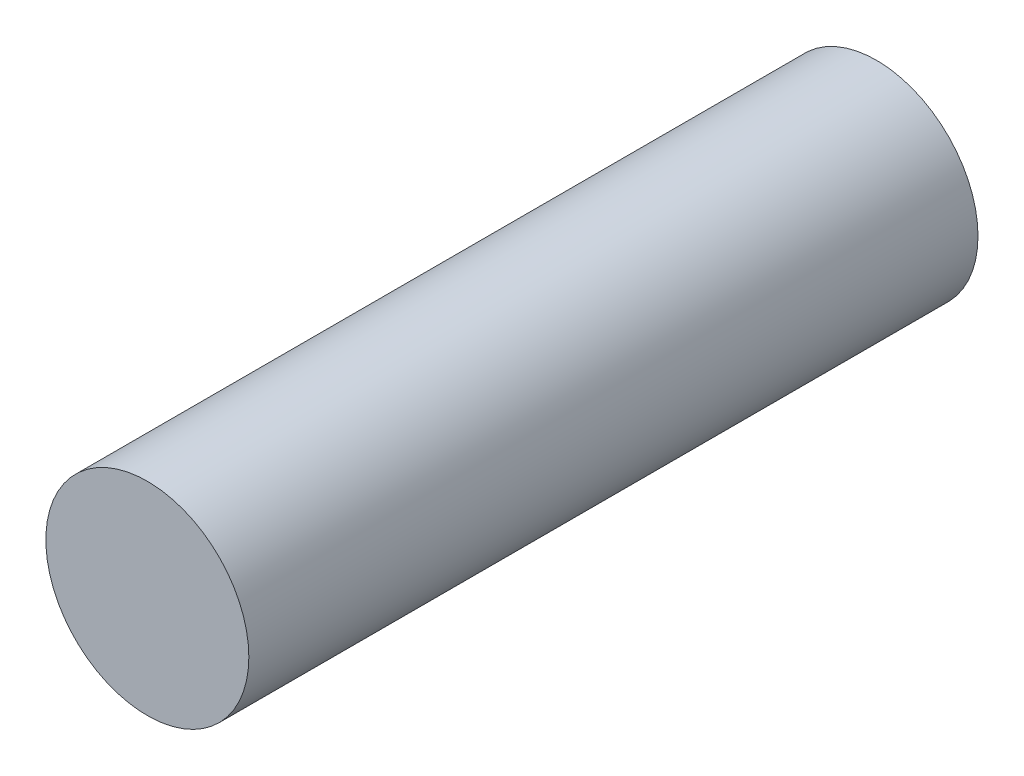
from build123d import *

# Parameters (mm, degrees)
SKETCH1_R           = 24.5
BOSS_EXTRUDE1_DEPTH = 176


with BuildPart() as part:
    # Sketch1 → Boss-Extrude1 (new body)
    with BuildSketch(Plane.XY):
        Circle(SKETCH1_R)
    extrude(amount=BOSS_EXTRUDE1_DEPTH)


solid = part.part
